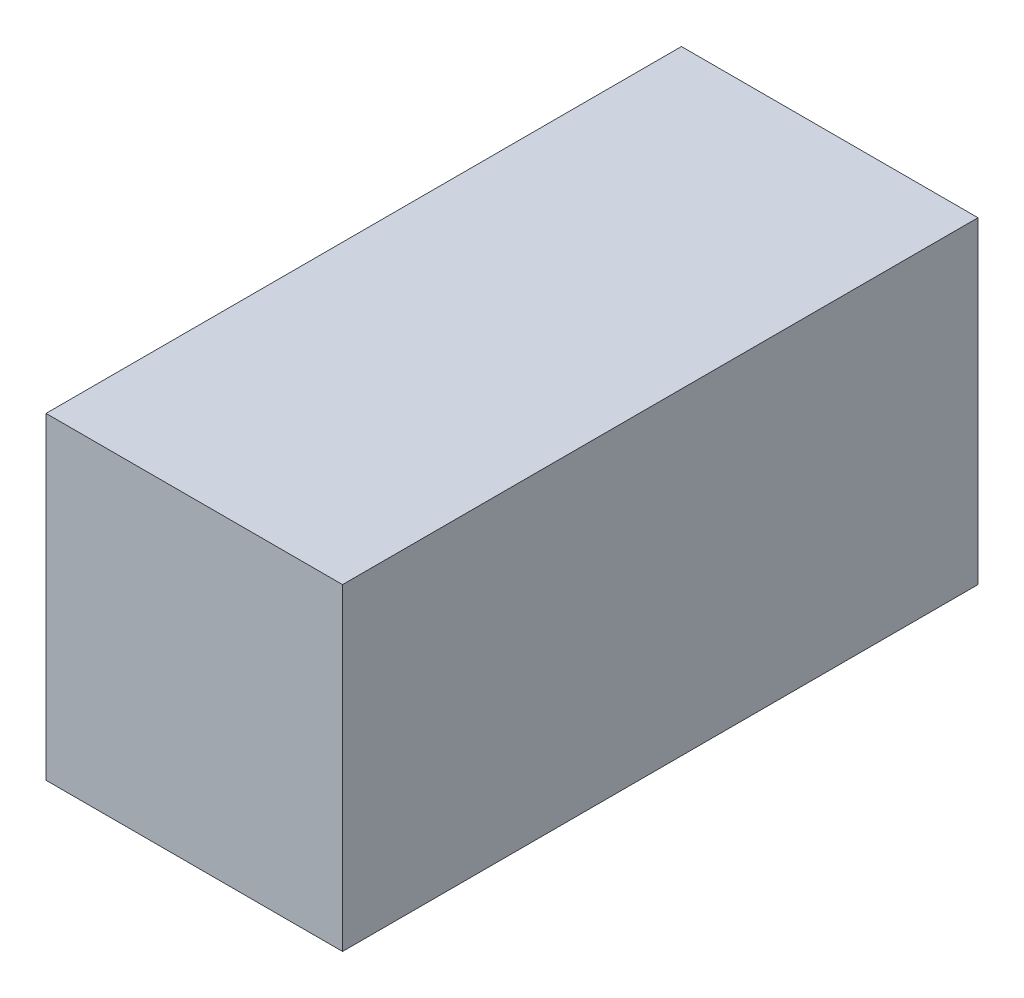
from build123d import *

# Parameters (mm, degrees)
STORE_KLAPE_KASET_KATI_DONMUS_KAP_2_1_START = -100
SKETCH1_W                                   = 140
SKETCH1_H                                   = 150
STORE_KLAPE_KASET_KATI_DONMUS_KAP_2_1_DEPTH = 300


with BuildPart() as part:
    # Sketch1 → STORE_klape_kaset_kati_donmus_kap_2_1 (new body)
    with BuildSketch(Plane.XY.offset(STORE_KLAPE_KASET_KATI_DONMUS_KAP_2_1_START)):
        with Locations((300, 480)):
            Rectangle(SKETCH1_W, SKETCH1_H)
    extrude(amount=-STORE_KLAPE_KASET_KATI_DONMUS_KAP_2_1_DEPTH)


solid = part.part
